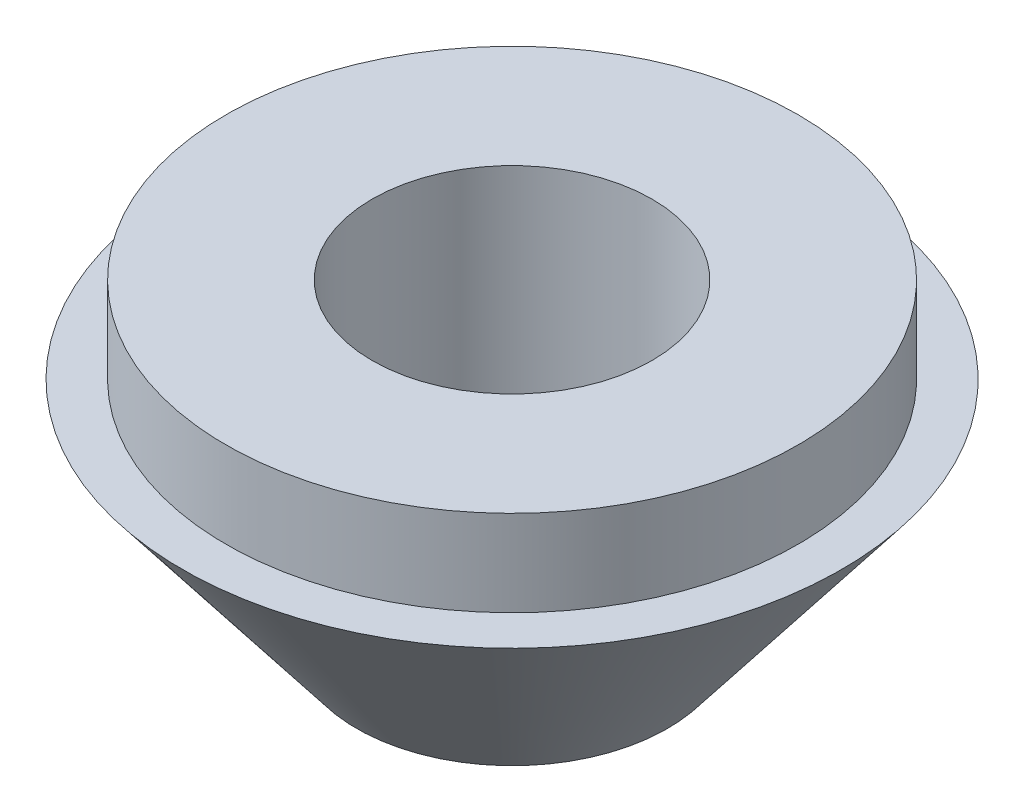
from build123d import *

# Parameters (mm, degrees)
SKETCH_362_R       = 5.715
CUT_EXTRUDE4_DEPTH = 12.7


with BuildPart() as part:
    # Sketch1 → Revolve1 (revolve)
    with BuildSketch(Plane.XY, mode=Mode.PRIVATE) as revolve1_sk:
        Polygon((0, 0), (0, 12.7), (-11.684, 12.7), (-11.684, 9.183788707), (-13.462, 9.183788707), (-6.35, 0), align=None)
    revolve(revolve1_sk.sketch.rotate(Axis((0, 0, 0), (0, 1, 0)), 270), axis=Axis((0, 0, 0), (0, 1, 0)))

    # Sketch 362 → Cut-Extrude4 (cut)
    with BuildSketch(Plane(origin=(0, 12.7, 0), x_dir=(1, 0, 0), z_dir=(0, 1, 0))):
        with Locations(Location((0, 0, 0), (0, 0, 270))):
            Circle(SKETCH_362_R)
    extrude(amount=-CUT_EXTRUDE4_DEPTH, mode=Mode.SUBTRACT)


solid = part.part
